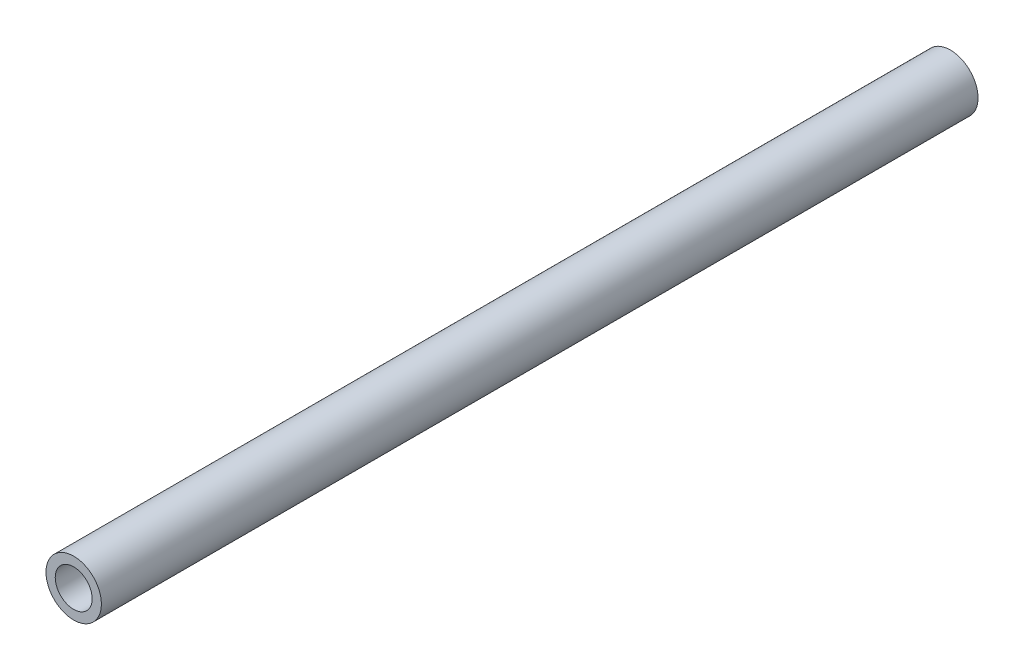
from build123d import *

# Parameters (mm, degrees)
POLE_CROSS_SECTION_SKETCH_R   = 30
POLE_CROSS_SECTION_SKETCH_R_2 = 20
PIPE_EXTRUDE_DEPTH            = 950


with BuildPart() as part:
    # Pole Cross Section Sketch → Pipe Extrude (new body)
    with BuildSketch(Plane.XY):
        with Locations(Location((0, 0, 0), (0, 0, 180))):
            Circle(POLE_CROSS_SECTION_SKETCH_R)
        with Locations(Location((0, 0, 0), (0, 0, 180))):
            Circle(POLE_CROSS_SECTION_SKETCH_R_2, mode=Mode.SUBTRACT)
    extrude(amount=PIPE_EXTRUDE_DEPTH)


solid = part.part
